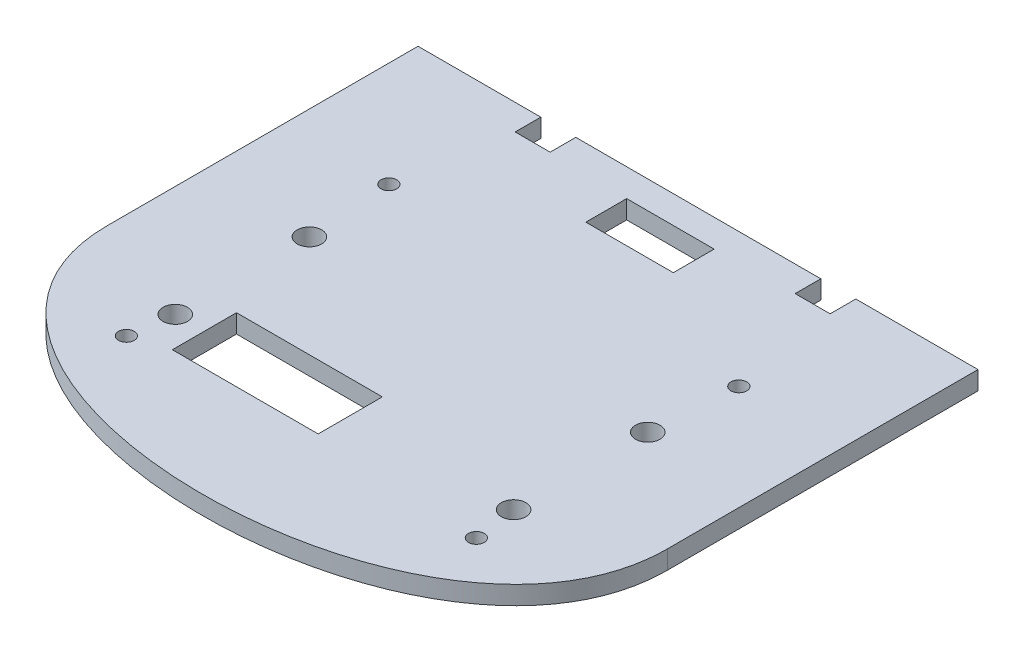
from build123d import *

# Parameters (mm, degrees)
BOSS_EXTRUDE1_DEPTH     = 3.175
CUT_EXTRUDE1_DEPTH      = 65.189801711
CUT_EXTRUDE1_DEPTH_BACK = 65.189801711
SKETCH3_R               = 1.35
SKETCH3_R_2             = 2.1
SKETCH3_W               = 15
SKETCH3_H               = 7
SKETCH3_W_2             = 25
SKETCH3_H_2             = 11
SKETCH5_W               = 6
SKETCH5_H               = 4.4
CUT_EXTRUDE2_DEPTH      = 65.189801711


with BuildPart() as part:
    # Sketch2 → Boss-Extrude1 (new body)
    with BuildSketch(Plane(origin=(0, 0, 0), x_dir=(1, 0, 0), z_dir=(0, 1, 0))):
        with BuildLine():
            Line((48, 42.5), (-48, 42.5))
            Line((-48, 42.5), (-48, -10.75))
            add(Edge.make_bspline(
                [(-48, -10.75), (-48, -53.083333333), (48, -53.083333333), (48, -10.75)],
                knots=[0, 0, 0, 0, 1, 1, 1, 1], degree=3))
            Line((48, -10.75), (48, 42.5))
        make_face()
    extrude(amount=BOSS_EXTRUDE1_DEPTH)

    # Sketch3 → Cut-Extrude1 (cut, two sides: drawn at the far end of the back side and taken through both)
    with BuildSketch(Plane(origin=(0, 3.175, 0), x_dir=(1, 0, 0), z_dir=(0, 1, 0)).offset(-CUT_EXTRUDE1_DEPTH_BACK)):
        with Locations(Location((-30, 19.5, 0), (0, 0, 270))):
            Circle(SKETCH3_R)
        with Locations(Location((-30, -25.5, 0), (0, 0, 270))):
            Circle(SKETCH3_R)
        with Locations(Location((30, -25.5, 0), (0, 0, 90))):
            Circle(SKETCH3_R)
        with Locations(Location((30, 19.5, 0), (0, 0, 90))):
            Circle(SKETCH3_R)
        with Locations(Location((-29, 4.881263298, 0), (0, 0, 270))):
            Circle(SKETCH3_R_2)
        with Locations(Location((-29, -18.118736702, 0), (0, 0, 270))):
            Circle(SKETCH3_R_2)
        with Locations(Location((29, -18.118736702, 0), (0, 0, 90))):
            Circle(SKETCH3_R_2)
        with Locations(Location((29, 4.881263298, 0), (0, 0, 90))):
            Circle(SKETCH3_R_2)
        with Locations((0, 34.265048758)):
            Rectangle(SKETCH3_W, SKETCH3_H)
        with Locations((-11.5, -18.118736702)):
            Rectangle(SKETCH3_W_2, SKETCH3_H_2)
    extrude(amount=CUT_EXTRUDE1_DEPTH + CUT_EXTRUDE1_DEPTH_BACK, mode=Mode.SUBTRACT)

    # Sketch5 → Cut-Extrude2 (cut, through all)
    with BuildSketch(Plane(origin=(0, 3.175, 0), x_dir=(1, 0, 0), z_dir=(0, 1, 0))):
        with Locations((24.051144599, 40.3)):
            Rectangle(SKETCH5_W, SKETCH5_H)
        with Locations((-23.948855401, 40.3)):
            Rectangle(SKETCH5_W, SKETCH5_H)
    extrude(amount=-CUT_EXTRUDE2_DEPTH, mode=Mode.SUBTRACT)


solid = part.part
